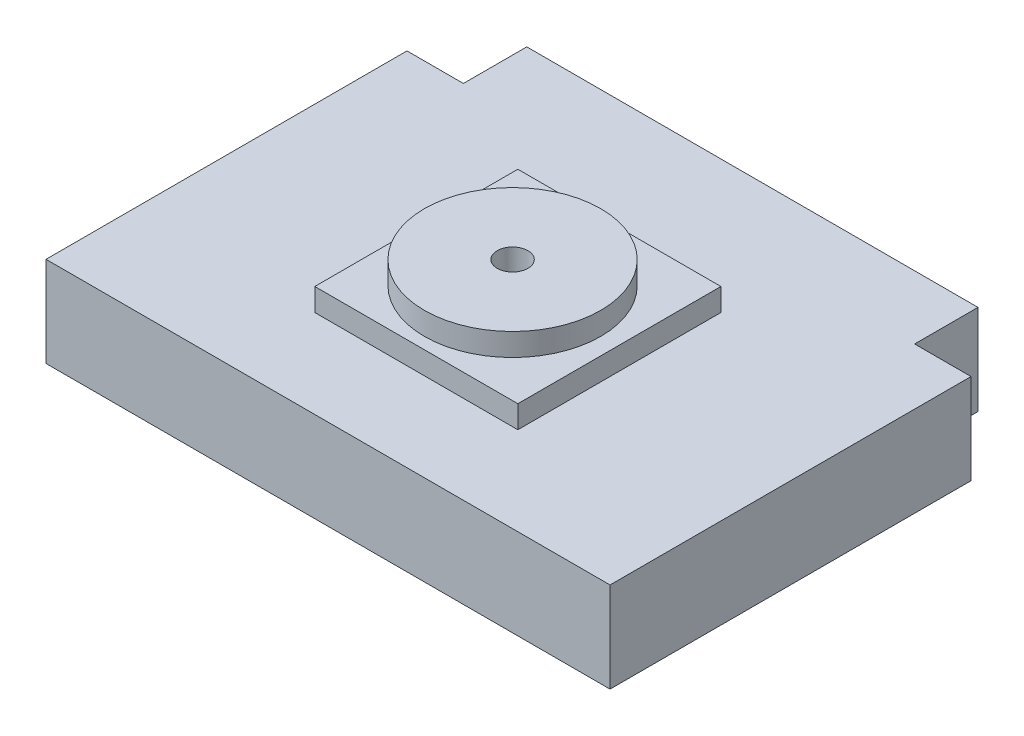
from build123d import *

# Parameters (mm, degrees)
BOSS_EXTRUDE1_DEPTH = 5.08
SKETCH3_W           = 11.43
SKETCH3_H           = 11.43
BOSS_EXTRUDE2_DEPTH = 1.27
SKETCH5_R           = 4.961688794
SKETCH5_R_2         = 0.865135847
BOSS_EXTRUDE3_DEPTH = 1.27


with BuildPart() as part:
    # Sketch1 → Boss-Extrude1 (new body)
    with BuildSketch(Plane(origin=(0, 0, 0), x_dir=(1, 0, 0), z_dir=(0, 1, 0))):
        Polygon((-19.516726296, 9.048937426), (5.883273704, 9.048937426), (5.883273704, 5.480342385), (9.058273704, 5.480342385), (9.058273704, -14.839657615), (-22.691726296, -14.839657615), (-22.691726296, 5.480342385), (-19.516726296, 5.480342385), align=None)
    extrude(amount=BOSS_EXTRUDE1_DEPTH)

    # Sketch3 → Boss-Extrude2 (add)
    with BuildSketch(Plane(origin=(0, 5.08, 0), x_dir=(1, 0, 0), z_dir=(0, 1, 0))):
        with Locations((-6.816726296, -4.154305268)):
            Rectangle(SKETCH3_W, SKETCH3_H)
    extrude(amount=BOSS_EXTRUDE2_DEPTH)

    # Sketch5 → Boss-Extrude3 (add)
    with BuildSketch(Plane(origin=(0, 6.35, 0), x_dir=(1, 0, 0), z_dir=(0, 1, 0))):
        with Locations(Location((-7.009181054, -4.258692446, 0), (0, 0, 270))):
            Circle(SKETCH5_R)
        with Locations(Location((-7.009181054, -4.258692446, 0), (0, 0, 270))):
            Circle(SKETCH5_R_2, mode=Mode.SUBTRACT)
    extrude(amount=BOSS_EXTRUDE3_DEPTH)


solid = part.part
